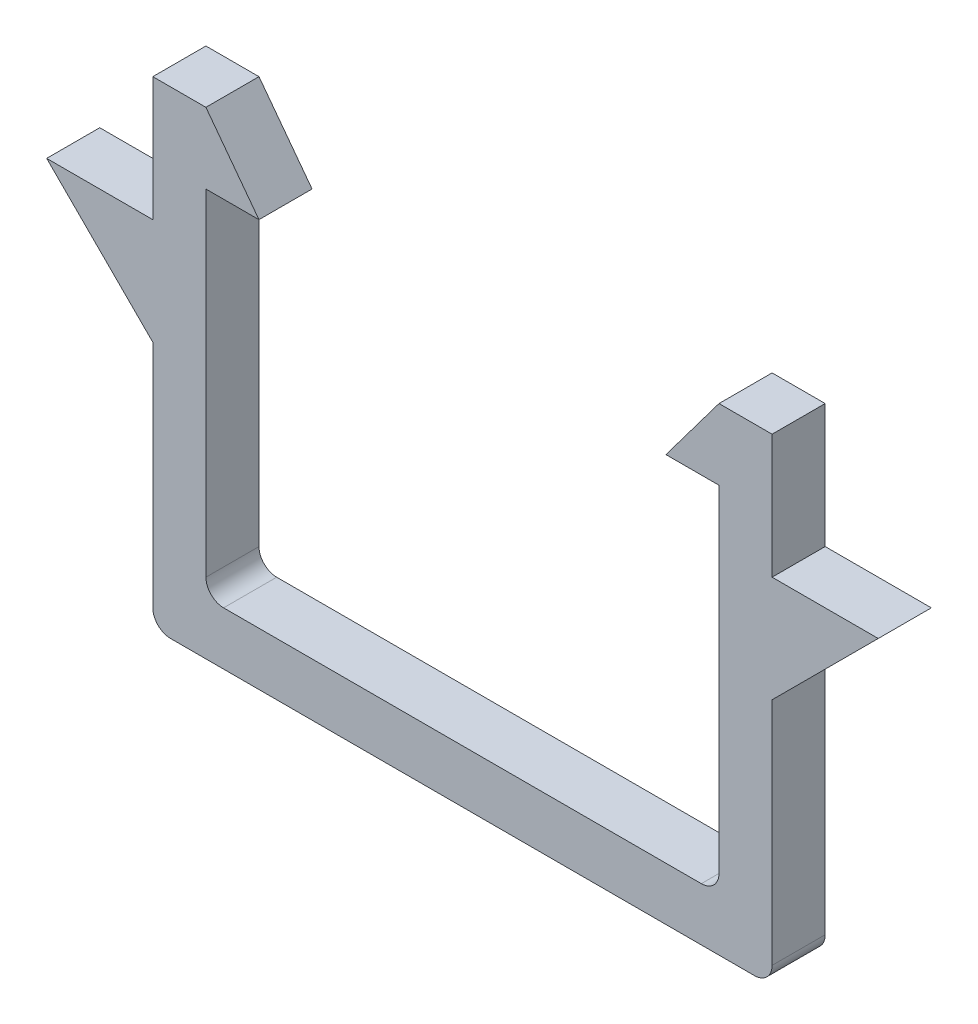
from build123d import *

# Parameters (mm, degrees)
BOSS_EXTRUDE1_DEPTH = 1.5


with BuildPart() as part:
    # Sketch1 → Boss-Extrude1 (new, symmetric)
    with BuildSketch(Plane.XY):
        with BuildLine():
            Line((-13.5, 3), (13.5, 3))
            ThreePointArc((13.5, 3), (14.207106781, 3.292893219), (14.5, 4))
            Line((14.5, 4), (14.5, 23))
            Line((14.5, 23), (11.5, 23))
            Line((11.5, 23), (14.5, 27))
            Line((14.5, 27), (17.5, 27))
            Line((17.5, 27), (17.5, 20))
            Line((17.5, 20), (23.5, 20))
            Line((23.5, 20), (17.5, 14))
            Line((17.5, 14), (17.5, 1))
            ThreePointArc((17.5, 1), (17.207106781, 0.292893219), (16.5, 0))
            Line((16.5, 0), (-16.5, 0))
            ThreePointArc((-16.5, 0), (-17.207106781, 0.292893219), (-17.5, 1))
            Line((-17.5, 1), (-17.5, 14))
            Line((-17.5, 14), (-23.5, 20))
            Line((-23.5, 20), (-17.5, 20))
            Line((-17.5, 20), (-17.5, 27))
            Line((-17.5, 27), (-14.5, 27))
            Line((-14.5, 27), (-11.5, 23))
            Line((-11.5, 23), (-14.5, 23))
            Line((-14.5, 23), (-14.5, 4))
            ThreePointArc((-14.5, 4), (-14.207106781, 3.292893219), (-13.5, 3))
        make_face()
    extrude(amount=BOSS_EXTRUDE1_DEPTH, both=True)


solid = part.part
